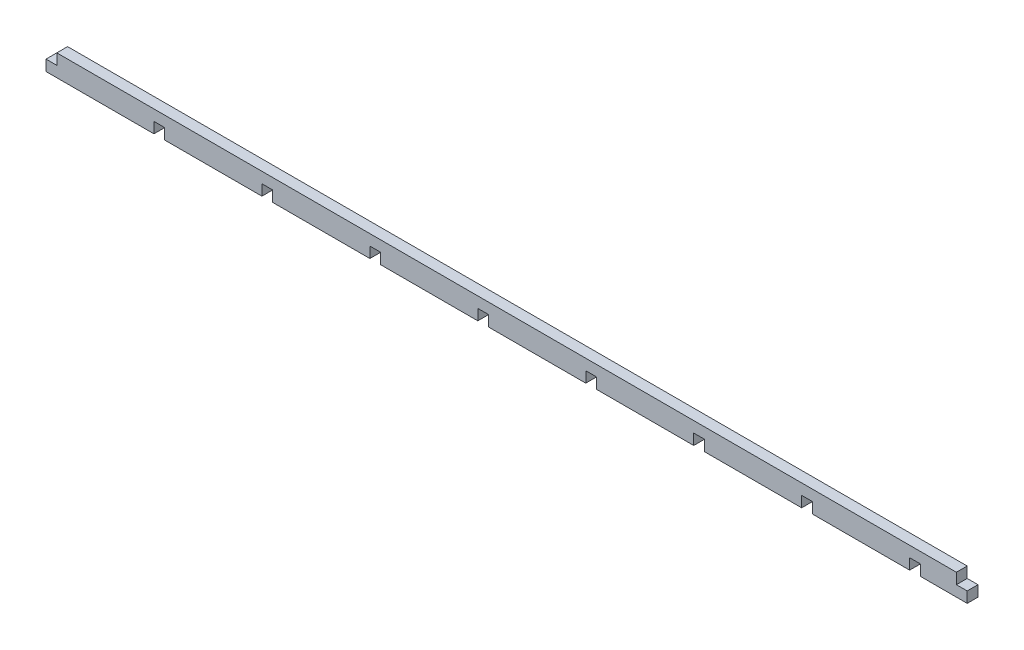
from build123d import *

# Parameters (mm, degrees)
BOSS_EXTRUDE2_DEPTH = 3


with BuildPart() as part:
    # Sketch2 → Boss-Extrude2 (new body)
    with BuildSketch(Plane.XY):
        Polygon((-107.113112534, 64.74485216), (-107.113112534, 61.74485216), (-134.113112534, 61.74485216), (-134.113112534, 64.74485216), (-137.113112534, 64.74485216), (-137.113112534, 61.74485216), (-164.113112534, 61.74485216), (-167.113112534, 61.74485216), (-167.113112534, 64.74485216), (-164.113112534, 64.74485216), (-164.113112534, 67.74485216), (85.886887466, 67.74485216), (85.886887466, 64.74485216), (88.886887466, 64.74485216), (88.886887466, 61.74485216), (85.886887466, 61.74485216), (75.886887466, 61.74485216), (75.886887466, 64.74485216), (72.886887466, 64.74485216), (72.886887466, 61.74485216), (45.886887466, 61.74485216), (45.886887466, 64.74485216), (42.886887466, 64.74485216), (42.886887466, 61.74485216), (15.886887466, 61.74485216), (15.886887466, 64.74485216), (12.886887466, 64.74485216), (12.886887466, 61.74485216), (-14.113112534, 61.74485216), (-14.113112534, 64.74485216), (-17.113112534, 64.74485216), (-17.113112534, 61.74485216), (-44.113112534, 61.74485216), (-44.113112534, 64.74485216), (-47.113112534, 64.74485216), (-47.113112534, 61.74485216), (-74.113112534, 61.74485216), (-74.113112534, 64.74485216), (-77.113112534, 64.74485216), (-77.113112534, 61.74485216), (-104.113112534, 61.74485216), (-104.113112534, 64.74485216), align=None)
    extrude(amount=BOSS_EXTRUDE2_DEPTH)


solid = part.part
